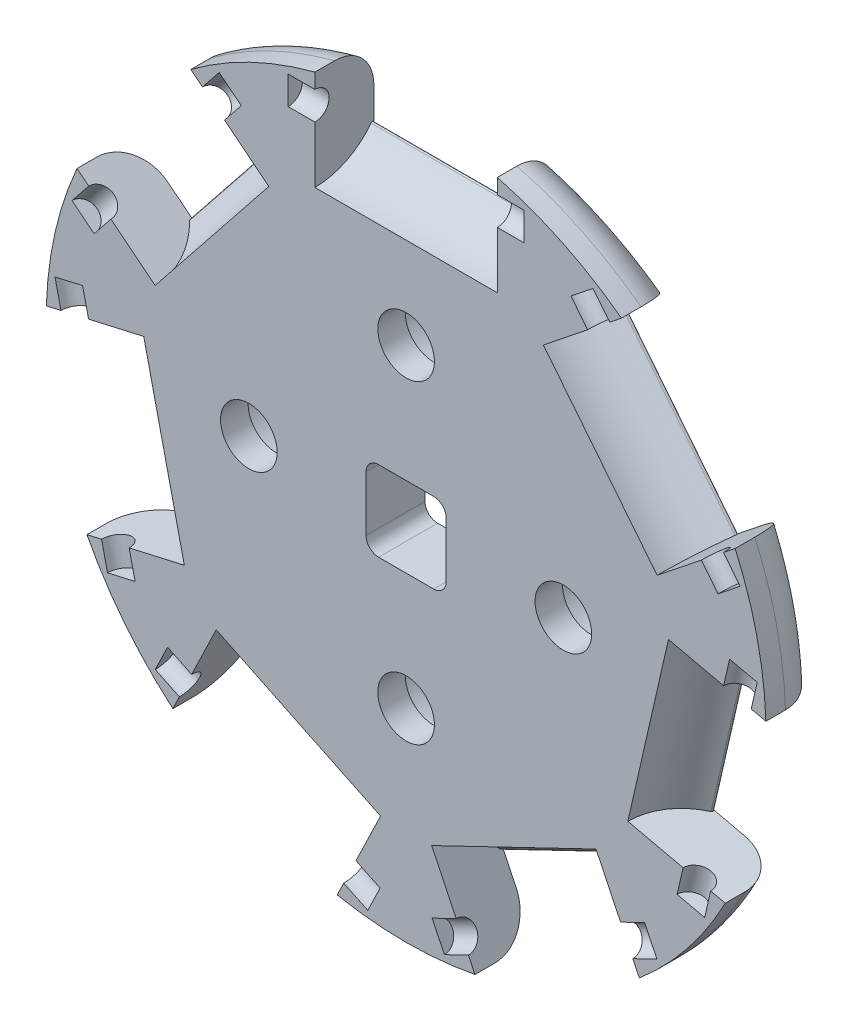
from build123d import *

# Parameters (mm, degrees)
SKETCH1_R                = 29.0703
BOSS_EXTRUDE2_DEPTH      = 4.7625
FILLET1_R                = 3.175
SKETCH2_W                = 14.732
SKETCH2_H                = 10.414
CUT_EXTRUDE2_DEPTH       = 12.7
CIRPATTERN1_COUNT        = 7
SKETCH4_R                = 1.143
CUT_EXTRUDE4_DEPTH       = 9.525
CIRPATTERN2_COUNT        = 7
SKETCH5_W                = 6.477
SKETCH5_H                = 6.477
CUT_EXTRUDE5_DEPTH       = 42.376236281
SKETCH6_R                = 2.286
CUT_EXTRUDE7_DEPTH       = 42.376236281
SKETCH7_R                = 4.445
CUT_EXTRUDE8_DEPTH       = 2.54
BOSS_EXTRUDE4_REACH      = 48.843
FILLET2_R                = 0.127
CIRPATTERN5_COUNT        = 7
FILLET2_OF_CIRPATTERN5_R = 0.127
FILLET3_R                = 1.016


with BuildPart() as part:
    # Sketch1 → Boss-Extrude2 (new body)
    with BuildSketch(Plane.XY):
        Circle(SKETCH1_R)
    extrude(amount=-BOSS_EXTRUDE2_DEPTH)

    # Fillet1
    fillet1_edges = [part.edges().sort_by_distance(p)[0] for p in [
        (-29.0703, 0, -4.7625),
    ]]
    fillet(fillet1_edges, radius=FILLET1_R)

    # Sketch2 → Cut-Extrude2 (cut)
    with BuildSketch(Plane.XY):
        with Locations((0, 25.1333)):
            Rectangle(SKETCH2_W, SKETCH2_H)
    cut_extrude2 = extrude(amount=-CUT_EXTRUDE2_DEPTH, mode=Mode.SUBTRACT)

    # CirPattern1: Cut-Extrude2 ×7 about axis
    cirpattern1_axis = Axis((0, 0, 0), (0, 0, 1))
    for i in range(1, CIRPATTERN1_COUNT):
        add(cut_extrude2.rotate(cirpattern1_axis, i * 360 / CIRPATTERN1_COUNT), mode=Mode.SUBTRACT)

    # Sketch4 → Cut-Extrude4 (cut, symmetric)
    with BuildSketch(Plane(origin=(0, 0, 0), x_dir=(0, 0, -1), z_dir=(1, 0, 0))):
        with Locations((0, 25.7683)):
            Circle(SKETCH4_R)
    cut_extrude4 = extrude(amount=CUT_EXTRUDE4_DEPTH, both=True, mode=Mode.SUBTRACT)

    # CirPattern2: Cut-Extrude4 ×7 about axis
    cirpattern2_axis = Axis((0, 0, 0), (0, 0, 1))
    for i in range(1, CIRPATTERN2_COUNT):
        add(cut_extrude4.rotate(cirpattern2_axis, i * 360 / CIRPATTERN2_COUNT), mode=Mode.SUBTRACT)

    # Sketch5 → Cut-Extrude5 (cut, through all)
    with BuildSketch(Plane.XY):
        Rectangle(SKETCH5_W, SKETCH5_H)
    extrude(amount=-CUT_EXTRUDE5_DEPTH, mode=Mode.SUBTRACT)

    # Sketch6 → Cut-Extrude7 (cut, through all)
    with BuildSketch(Plane(origin=(0, 0, -4.7625), x_dir=(-1, 0, 0), z_dir=(0, 0, -1))):
        with Locations((12.7, 0)):
            Circle(SKETCH6_R)
        with Locations((0, -12.7)):
            Circle(SKETCH6_R)
        with Locations((-12.7, 0)):
            Circle(SKETCH6_R)
        with Locations((0, 12.7)):
            Circle(SKETCH6_R)
    extrude(amount=-CUT_EXTRUDE7_DEPTH, mode=Mode.SUBTRACT)

    # Sketch7 → Cut-Extrude8 (cut)
    with BuildSketch(Plane(origin=(0, 0, -4.7625), x_dir=(-1, 0, 0), z_dir=(0, 0, -1))):
        with Locations((12.7, 0)):
            Circle(SKETCH7_R)
        with Locations((0, -12.7)):
            Circle(SKETCH7_R)
        with Locations((-12.7, 0)):
            Circle(SKETCH7_R)
        with Locations((0, 12.7)):
            Circle(SKETCH7_R)
    extrude(amount=-CUT_EXTRUDE8_DEPTH, mode=Mode.SUBTRACT)

    # Sketch10 → Boss-Extrude4 (add, up to next)
    with BuildSketch(Plane.ZY.offset(-7.366), mode=Mode.PRIVATE) as boss_extrude4_sk1:
        with BuildLine():
            Line((-4.7625, 19.9263), (0, 19.9263))
            Line((0, 19.9263), (0, 20.0533))
            ThreePointArc((0, 20.0533), (-2.7025038, 20.73265722), (-4.7625, 22.609214887))
            Line((-4.7625, 22.609214887), (-4.7625, 19.9263))
        make_face()
    boss_extrude4_tool1 = extrude(boss_extrude4_sk1.sketch, amount=BOSS_EXTRUDE4_REACH, mode=Mode.PRIVATE) - part.part
    boss_extrude4 = boss_extrude4_tool1.solids().sort_by_distance((7.366, 20.664807, -3.452063))[0]
    add(boss_extrude4)

    # Fillet2
    fillet2_edges = [part.edges().sort_by_distance(p)[0] for p in [
        (0, 22.609214887, -4.7625),
    ]]
    fillet(fillet2_edges, radius=FILLET2_R)

    # CirPattern5: Boss-Extrude4 ×7 about axis
    cirpattern5_axis = Axis((0, 0, 0), (0, 0, 1))
    for i in range(1, CIRPATTERN5_COUNT):
        add(boss_extrude4.rotate(cirpattern5_axis, i * 360 / CIRPATTERN5_COUNT))

    # Fillet2 of CirPattern5
    fillet2_of_cirpattern5_edges = [part.edges().sort_by_distance(p)[0] for p in [
        (-17.676595993, 14.09661491, -4.7625),
        (-22.042354666, -5.031023613, -4.7625),
        (-9.809770694, -20.370198741, -4.7625),
        (9.809770694, -20.370198741, -4.7625),
        (22.042354666, -5.031023613, -4.7625),
        (17.676595993, 14.09661491, -4.7625),
    ]]
    fillet(fillet2_of_cirpattern5_edges, radius=FILLET2_OF_CIRPATTERN5_R)

    # Fillet3
    fillet3_edges = [part.edges().sort_by_distance(p)[0] for p in [
        (3.2385, 3.2385, -2.38125),
        (3.2385, -3.2385, -2.38125),
        (-3.2385, -3.2385, -2.38125),
        (-3.2385, 3.2385, -2.38125),
    ]]
    fillet(fillet3_edges, radius=FILLET3_R)


solid = part.part
